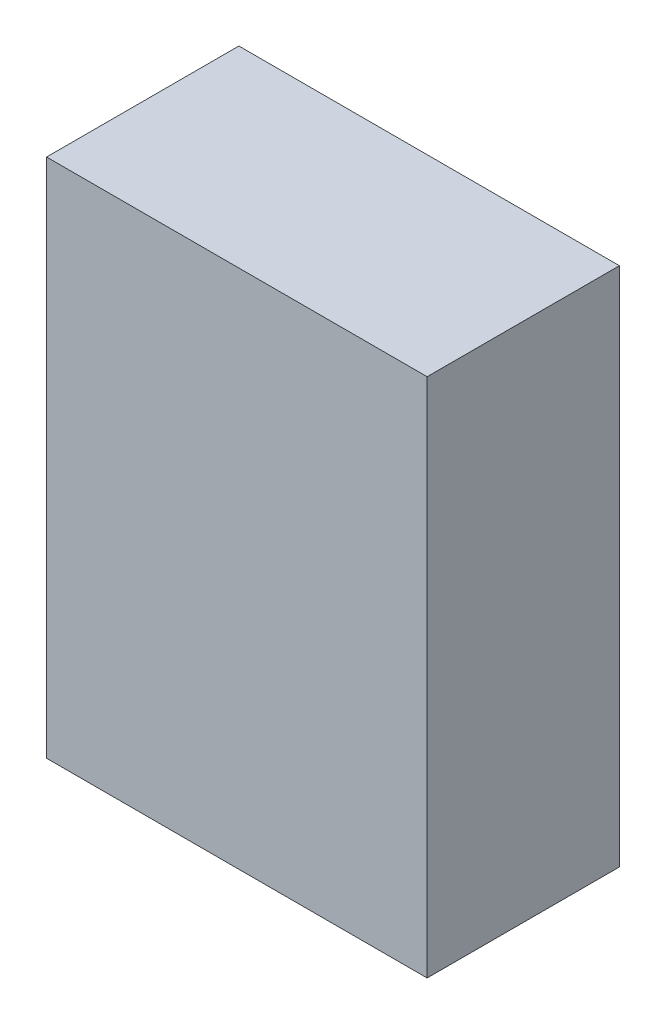
from build123d import *

# Parameters (mm, degrees)
ESQUISSE1_W        = 47.5
ESQUISSE1_H        = 65
BOSS_EXTRU_1_DEPTH = 24


with BuildPart() as part:
    # Esquisse1 → Boss.-Extru.1 (new body)
    with BuildSketch(Plane.XY):
        with Locations((23.75, 32.5)):
            Rectangle(ESQUISSE1_W, ESQUISSE1_H)
    extrude(amount=BOSS_EXTRU_1_DEPTH)


solid = part.part
